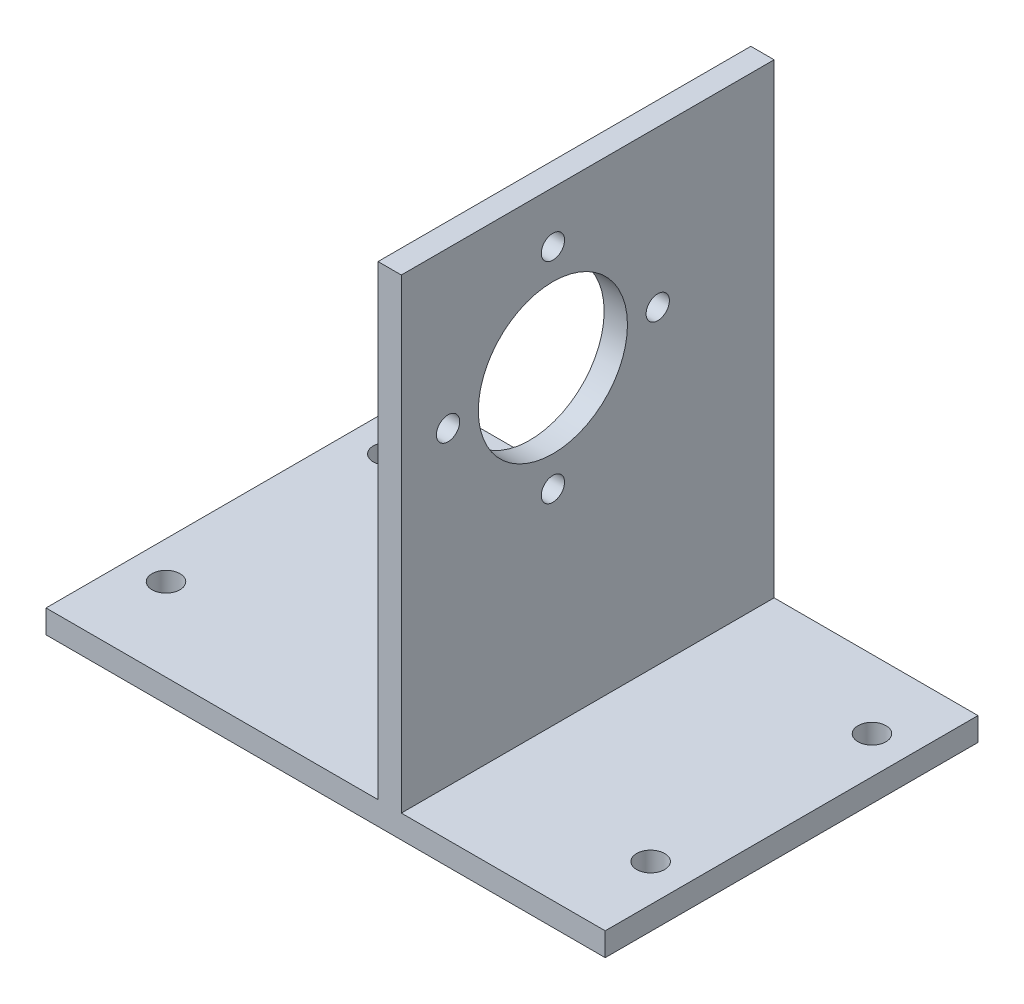
from build123d import *

# Parameters (mm, degrees)
SKETCH1_W               = 120
SKETCH1_H               = 80
SKETCH1_R               = 3
BOSS_EXTRUDE1_DEPTH     = 5
SKETCH2_W               = 5
SKETCH2_H               = 80
BOSS_EXTRUDE2_DEPTH     = 100
CUT_EXTRUDE1_DEPTH      = 136.790509609
CUT_EXTRUDE1_DEPTH_BACK = 136.790509609
SKETCH3_R               = 16
SKETCH3_R_2             = 2.5


with BuildPart() as part:
    # Sketch1 → Boss-Extrude1 (new body)
    with BuildSketch(Plane(origin=(0, 0, 0), x_dir=(1, 0, 0), z_dir=(0, 1, 0))):
        Rectangle(SKETCH1_W, SKETCH1_H)
        with Locations(Location((-52, 25.25, 0), (0, 0, 270))):
            Circle(SKETCH1_R, mode=Mode.SUBTRACT)
        with Locations(Location((-52, -22.25, 0), (0, 0, 270))):
            Circle(SKETCH1_R, mode=Mode.SUBTRACT)
        with Locations(Location((52, -22.25, 0), (0, 0, 270))):
            Circle(SKETCH1_R, mode=Mode.SUBTRACT)
        with Locations(Location((52, 25.25, 0), (0, 0, 270))):
            Circle(SKETCH1_R, mode=Mode.SUBTRACT)
    extrude(amount=BOSS_EXTRUDE1_DEPTH)

    # Sketch2 → Boss-Extrude2 (add)
    with BuildSketch(Plane(origin=(0, 5, 0), x_dir=(1, 0, 0), z_dir=(0, 1, 0))):
        with Locations((13.75, 0)):
            Rectangle(SKETCH2_W, SKETCH2_H)
    extrude(amount=BOSS_EXTRUDE2_DEPTH)

    # Sketch3 → Cut-Extrude1 (cut, two sides: drawn at the far end of the back side and taken through both)
    with BuildSketch(Plane(origin=(16.25, 0, 0), x_dir=(0, 0, -1), z_dir=(1, 0, 0)).offset(-CUT_EXTRUDE1_DEPTH_BACK)):
        with Locations((-7.473800103, 71.5)):
            Circle(SKETCH3_R)
        with Locations((-29.973800103, 71.5)):
            Circle(SKETCH3_R_2)
        with Locations((15.026199897, 71.5)):
            Circle(SKETCH3_R_2)
        with Locations((-7.473800103, 49)):
            Circle(SKETCH3_R_2)
        with Locations((-7.473800103, 94)):
            Circle(SKETCH3_R_2)
    extrude(amount=CUT_EXTRUDE1_DEPTH + CUT_EXTRUDE1_DEPTH_BACK, mode=Mode.SUBTRACT)


solid = part.part
